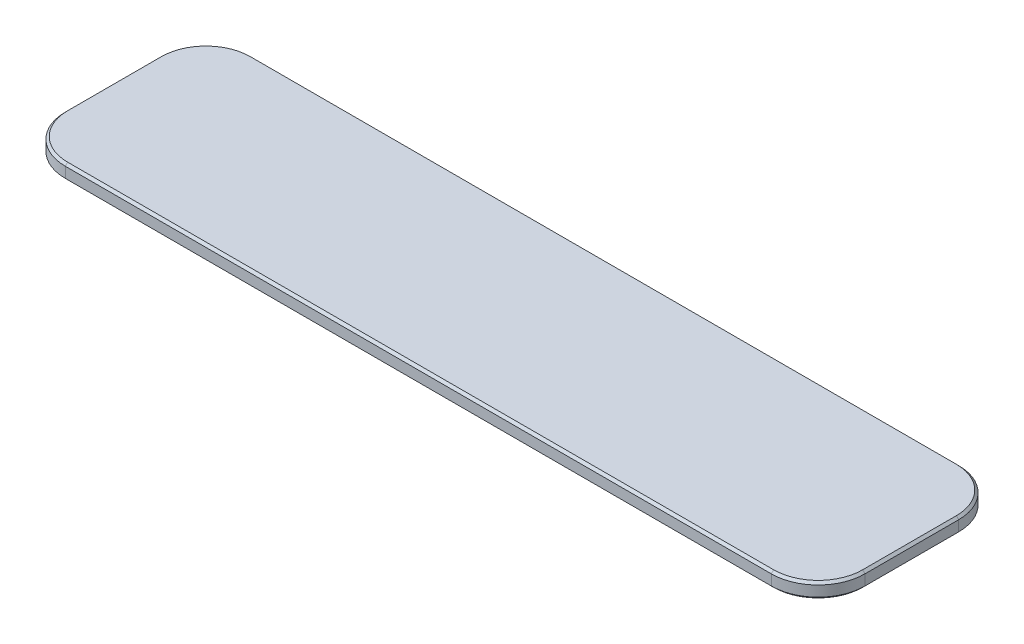
from build123d import *

# Parameters (mm, degrees)
SKETCH1_W           = 341.35
SKETCH1_H           = 80
BOSS_EXTRUDE1_DEPTH = 6.5
FILLET1_R           = 20
CHAMFER1_SIZE       = 1


with BuildPart() as part:
    # Sketch1 → Boss-Extrude1 (new body)
    with BuildSketch(Plane(origin=(0, 0, 0), x_dir=(1, 0, 0), z_dir=(0, 1, 0))):
        Rectangle(SKETCH1_W, SKETCH1_H)
    extrude(amount=BOSS_EXTRUDE1_DEPTH)

    # Fillet1
    fillet1_edges = [part.edges().sort_by_distance(p)[0] for p in [
        (170.675, 3.25, 40),
        (-170.675, 3.25, 40),
        (-170.675, 3.25, -40),
        (170.675, 3.25, -40),
    ]]
    fillet(fillet1_edges, radius=FILLET1_R)

    # Chamfer1
    chamfer1_edges = [part.edges().sort_by_distance(p)[0] for p in [
        (170.675, 0, 0),
        (170.675, 6.5, 0),
        (0, 0, 40),
        (-170.675, 0, 0),
        (0, 0, -40),
        (-164.817135624, 0, 34.142135624),
        (164.817135624, 0, -34.142135624),
        (-164.817135624, 0, -34.142135624),
        (164.817135624, 0, 34.142135624),
        (0, 6.5, 40),
        (0, 6.5, -40),
        (-170.675, 6.5, 0),
        (-164.817135624, 6.5, 34.142135624),
        (164.817135624, 6.5, -34.142135624),
        (-164.817135624, 6.5, -34.142135624),
        (164.817135624, 6.5, 34.142135624),
    ]]
    chamfer(chamfer1_edges, length=CHAMFER1_SIZE)


solid = part.part
